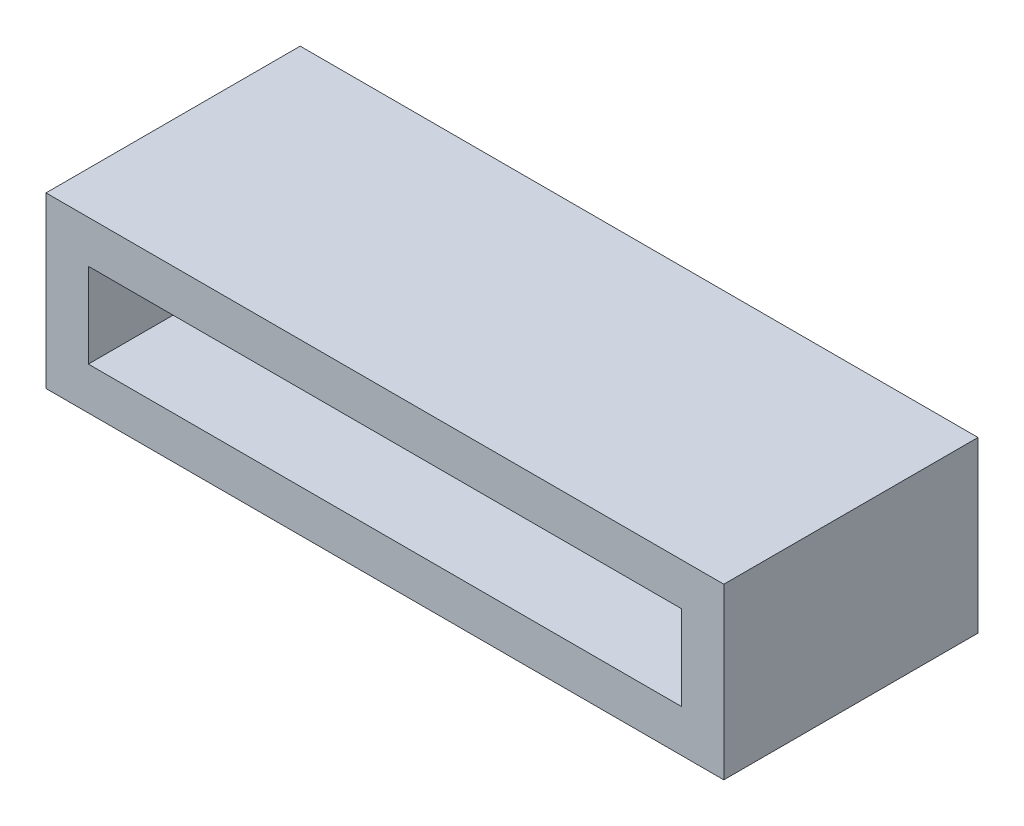
from build123d import *

# Parameters (mm, degrees)
SKETCH_1_W      = 16
SKETCH_1_H      = 4
SKETCH_1_W_2    = 14
SKETCH_1_H_2    = 2
EXTRUDE_1_DEPTH = 6


with BuildPart() as part:
    # 草图1 → 凸台-拉伸1 (new body)
    with BuildSketch(Plane.XY):
        Rectangle(SKETCH_1_W, SKETCH_1_H)
        Rectangle(SKETCH_1_W_2, SKETCH_1_H_2, mode=Mode.SUBTRACT)
    extrude(amount=EXTRUDE_1_DEPTH)


solid = part.part
